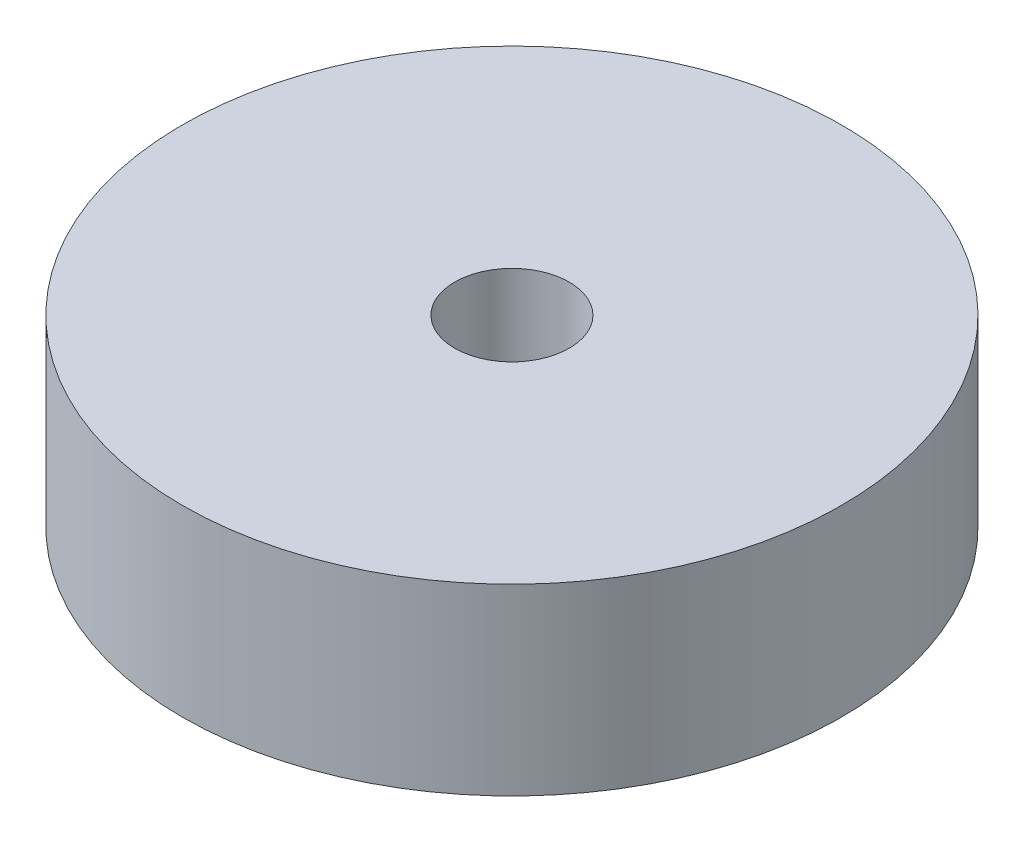
from build123d import *

# Parameters (mm, degrees)
SKETCH1_R           = 36.5125
SKETCH1_R_2         = 6.35
BOSS_EXTRUDE1_DEPTH = 20.32


with BuildPart() as part:
    # Sketch1 → Boss-Extrude1 (new body)
    with BuildSketch(Plane(origin=(0, 0, 0), x_dir=(1, 0, 0), z_dir=(0, 1, 0))):
        with Locations(Location((0, 0, 0), (0, 0, 270))):
            Circle(SKETCH1_R)
        with Locations(Location((0, 0, 0), (0, 0, 270))):
            Circle(SKETCH1_R_2, mode=Mode.SUBTRACT)
    extrude(amount=BOSS_EXTRUDE1_DEPTH)


solid = part.part
